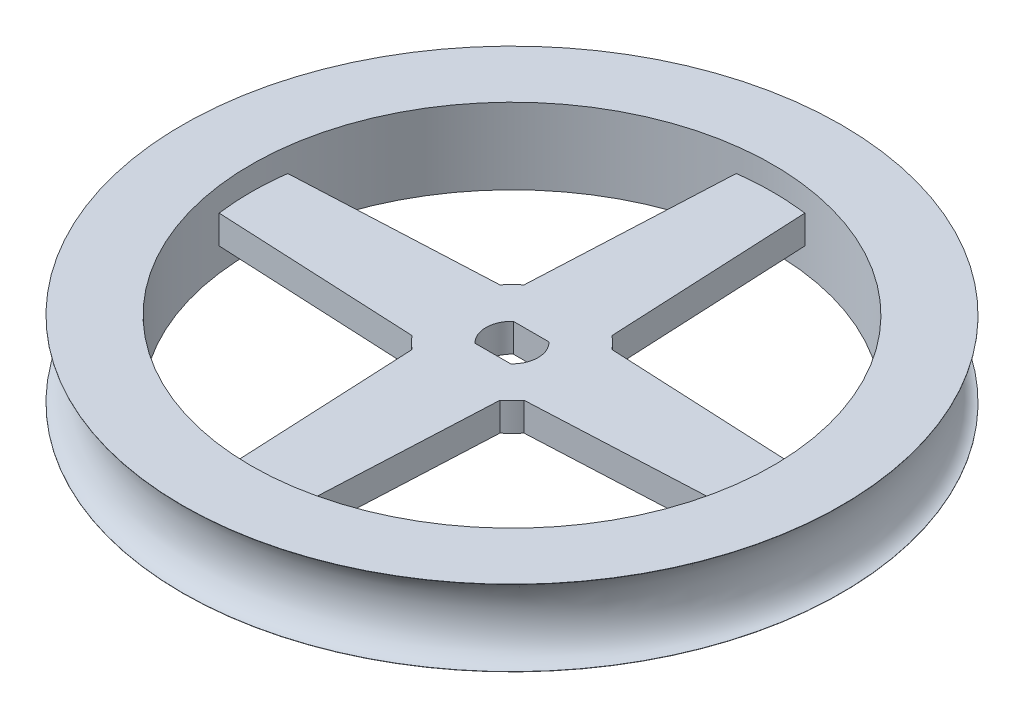
from build123d import *

# Parameters (mm, degrees)
SKETCH1_R           = 35
SKETCH1_R_2         = 27.5
BOSS_EXTRUDE3_DEPTH = 4
BOSS_EXTRUDE4_DEPTH = 1.5
SKETCH6_W           = 1.276333044
SKETCH6_H           = 9.874787235


with BuildPart() as part:
    # Sketch1 → Boss-Extrude3 (new, symmetric)
    with BuildSketch(Plane(origin=(0, 0, 0), x_dir=(1, 0, 0), z_dir=(0, 1, 0))):
        with Locations(Location((0, 0, 0), (0, 0, 270))):
            Circle(SKETCH1_R)
        with Locations(Location((0, 0, 0), (0, 0, 270))):
            Circle(SKETCH1_R_2, mode=Mode.SUBTRACT)
    extrude(amount=BOSS_EXTRUDE3_DEPTH, both=True)

    # Sketch4 → Cut-Revolve2 (revolve, cut)
    with BuildSketch(Plane(origin=(0, 0, 0), x_dir=(0, 0, -1), z_dir=(1, 0, 0))):
        with BuildLine():
            Line((-35, 4), (-35, -4))
            add(Edge.make_bspline(
                [(-35, -4), (-32.536361471, -4), (-32.536361471, 0)],
                knots=[0, 0, 0, 1.570796327, 1.570796327, 1.570796327], degree=2, weights=[1, 0.707106781, 1]))
            add(Edge.make_bspline(
                [(-32.536361471, 0), (-32.536361471, 4), (-35, 4)],
                knots=[4.71238898, 4.71238898, 4.71238898, 6.283185307, 6.283185307, 6.283185307], degree=2, weights=[1, 0.707106781, 1]))
        make_face()
    revolve(axis=Axis((0, 4.568524564, 0), (0, -1, 0)), mode=Mode.SUBTRACT)

    # Sketch6 → Cut-Revolve3 (revolve, cut)
    with BuildSketch(Plane.XY, mode=Mode.PRIVATE) as cut_revolve3_sk:
        with Locations((-35.377775098, 0.321071025)):
            Rectangle(SKETCH6_W, SKETCH6_H)
    revolve(cut_revolve3_sk.sketch.rotate(Axis((0, 8.792459599, 0), (0, -1, 0)), 270), axis=Axis((0, 8.792459599, 0), (0, -1, 0)), mode=Mode.SUBTRACT)


with BuildPart() as body_2:
    # Sketch5 → Boss-Extrude4 (new, symmetric)
    with BuildSketch(Plane(origin=(0, 0, 0), x_dir=(1, 0, 0), z_dir=(0, 1, 0))):
        with BuildLine():
            Line((-3.614935254, 27.261369062), (-4.631392956, 5.899169373))
            ThreePointArc((-4.631392956, 5.899169373), (-5.303300859, 5.303300859), (-5.899169373, 4.631392956))
            Line((-5.899169373, 4.631392956), (-27.261369062, 3.614935254))
            ThreePointArc((-27.261369062, 3.614935254), (-27.5, 0), (-27.261369062, -3.614935254))
            Line((-27.261369062, -3.614935254), (-5.899169373, -4.631392956))
            ThreePointArc((-5.899169373, -4.631392956), (-5.303300859, -5.303300859), (-4.631392956, -5.899169373))
            Line((-4.631392956, -5.899169373), (-3.614935254, -27.261369062))
            ThreePointArc((-3.614935254, -27.261369062), (0, -27.5), (3.614935254, -27.261369062))
            Line((3.614935254, -27.261369062), (4.631392956, -5.899169373))
            ThreePointArc((4.631392956, -5.899169373), (5.303300859, -5.303300859), (5.899169373, -4.631392956))
            Line((5.899169373, -4.631392956), (27.261369062, -3.614935254))
            ThreePointArc((27.261369062, -3.614935254), (27.5, 0), (27.261369062, 3.614935254))
            Line((27.261369062, 3.614935254), (5.899169373, 4.631392956))
            ThreePointArc((5.899169373, 4.631392956), (5.303300859, 5.303300859), (4.631392956, 5.899169373))
            Line((4.631392956, 5.899169373), (3.614935254, 27.261369062))
            ThreePointArc((3.614935254, 27.261369062), (0, 27.5), (-3.614935254, 27.261369062))
        make_face()
        with BuildLine():
            Line((-1.875, 2.011684617), (1.875, 2.011684617))
            ThreePointArc((1.875, 2.011684617), (2.75, 0), (1.875, -2.011684617))
            Line((1.875, -2.011684617), (-1.875, -2.011684617))
            ThreePointArc((-1.875, -2.011684617), (-2.75, 0), (-1.875, 2.011684617))
        make_face(mode=Mode.SUBTRACT)
    extrude(amount=BOSS_EXTRUDE4_DEPTH, both=True)


solid = Compound([part.part, body_2.part])
